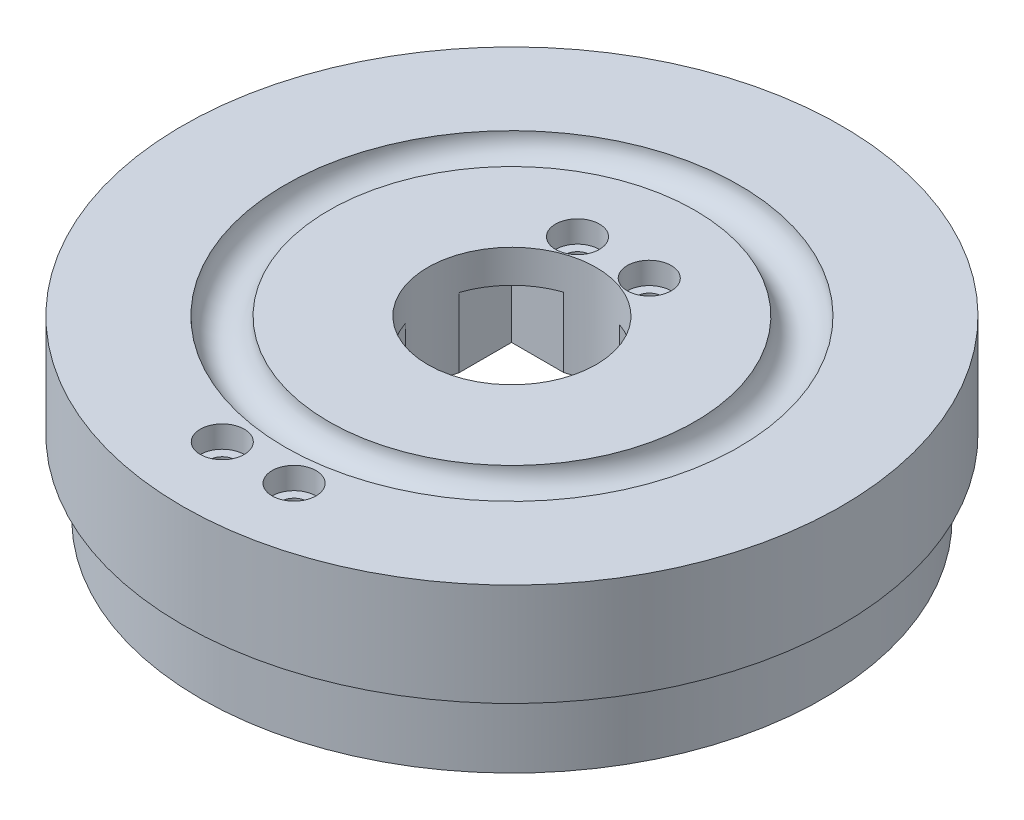
from build123d import *

# Parameters (mm, degrees)
SKETCH1_R           = 45
SKETCH1_R_2         = 11.5
BOSS_EXTRUDE1_DEPTH = 14
SKETCH3_R           = 3
SKETCH6_R           = 3
CUT_EXTRUDE3_DEPTH  = 3
SKETCH7_R           = 1.75
CUT_EXTRUDE4_DEPTH  = 13
SKETCH8_W           = 21.8
SKETCH8_H           = 42.5
CUT_EXTRUDE7_DEPTH  = 9.5
SKETCH9_R           = 42.5
SKETCH9_R_2         = 40.5
BOSS_EXTRUDE2_DEPTH = 10


with BuildPart() as part:
    # Sketch1 → Boss-Extrude1 (new body)
    with BuildSketch(Plane(origin=(0, 0, 0), x_dir=(1, 0, 0), z_dir=(0, 1, 0))):
        with Locations(Location((0, 0, 0), (0, 0, 270))):
            Circle(SKETCH1_R)
        with Locations(Location((0, 0, 0), (0, 0, 270))):
            Circle(SKETCH1_R_2, mode=Mode.SUBTRACT)
    extrude(amount=BOSS_EXTRUDE1_DEPTH)

    # Sketch3 → Cut-Revolve1 (revolve, cut)
    with BuildSketch(Plane.XY, mode=Mode.PRIVATE) as cut_revolve1_sk:
        with Locations((-28, 14)):
            Circle(SKETCH3_R)
    revolve(cut_revolve1_sk.sketch.rotate(Axis((0, 14, 0), (0, -1, 0)), 270), axis=Axis((0, 14, 0), (0, -1, 0)), mode=Mode.SUBTRACT)

    # Sketch6 → Cut-Extrude3 (cut)
    with BuildSketch(Plane(origin=(0, 14, 0), x_dir=(1, 0, 0), z_dir=(0, 1, 0))):
        with Locations(Location((-4.9, -34.65, 0), (0, 0, 270))):
            Circle(SKETCH6_R)
        with Locations(Location((4.9, -34.65, 0), (0, 0, 270))):
            Circle(SKETCH6_R)
        with Locations(Location((-4.9, 13.85, 0), (0, 0, 270))):
            Circle(SKETCH6_R)
        with Locations(Location((4.9, 13.85, 0), (0, 0, 270))):
            Circle(SKETCH6_R)
    extrude(amount=-CUT_EXTRUDE3_DEPTH, mode=Mode.SUBTRACT)

    # Sketch7 → Cut-Extrude4 (cut)
    with BuildSketch(Plane.XZ):
        with Locations(Location((4.9, 34.65, 0), (0, 0, 270))):
            Circle(SKETCH7_R)
        with Locations(Location((-4.9, 34.65, 0), (0, 0, 270))):
            Circle(SKETCH7_R)
        with Locations(Location((4.9, -13.85, 0), (0, 0, 270))):
            Circle(SKETCH7_R)
        with Locations(Location((-4.9, -13.85, 0), (0, 0, 270))):
            Circle(SKETCH7_R)
    extrude(amount=-CUT_EXTRUDE4_DEPTH, mode=Mode.SUBTRACT)

    # Sketch8 → Cut-Extrude7 (cut)
    with BuildSketch(Plane.XZ):
        with Locations((0, 10.4)):
            Rectangle(SKETCH8_W, SKETCH8_H)
    extrude(amount=-CUT_EXTRUDE7_DEPTH, mode=Mode.SUBTRACT)

    # Sketch9 → Boss-Extrude2 (add)
    with BuildSketch(Plane.XZ):
        with Locations(Location((0, 0, 0), (0, 0, 90))):
            Circle(SKETCH9_R)
        with Locations(Location((0, 0, 0), (0, 0, 270))):
            Circle(SKETCH9_R_2, mode=Mode.SUBTRACT)
    extrude(amount=BOSS_EXTRUDE2_DEPTH)


solid = part.part
